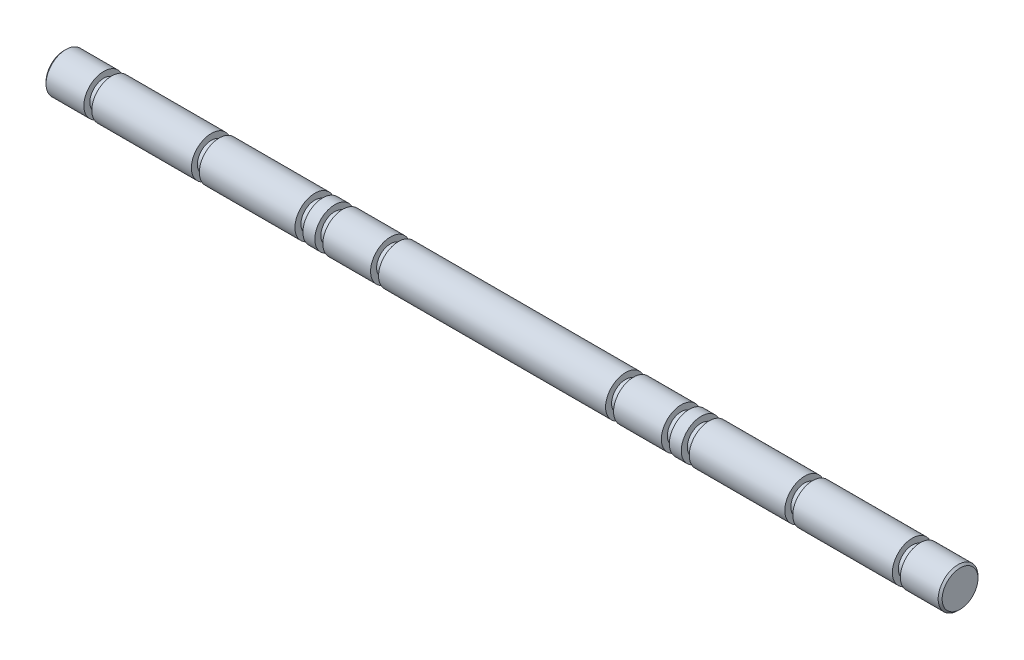
from build123d import *

# Parameters (mm, degrees)
SKETCH_4_R       = 5
EXTRUDE_4_DEPTH  = 57
SKETCH_5_R       = 3.5
EXTRUDE_5_DEPTH  = 2
EXTRUDE_START    = 12
SKETCH_6_R       = 5
EXTRUDE_6_DEPTH  = 12
EXTRUDE_START_2  = 2
SKETCH_7_R       = 3.5
EXTRUDE_7_DEPTH  = 2
SKETCH_8_R       = 5
EXTRUDE_8_DEPTH  = 12
SKETCH_9_R       = 3.5
EXTRUDE_9_DEPTH  = 2
SKETCH_10_R      = 5
EXTRUDE_10_DEPTH = 3
SKETCH_11_R      = 3.5
EXTRUDE_11_DEPTH = 2
SKETCH_12_R      = 5
EXTRUDE_12_DEPTH = 24
SKETCH_13_R      = 3.5
EXTRUDE_13_DEPTH = 2
SKETCH_14_R      = 5
EXTRUDE_14_DEPTH = 25
SKETCH_15_R      = 3.5
EXTRUDE_15_DEPTH = 2
SKETCH_16_R      = 5
EXTRUDE_16_DEPTH = 10
SKETCH_33_R      = 3.5
EXTRUDE_25_DEPTH = 2
EXTRUDE_START_3  = 3
SKETCH_34_R      = 5
EXTRUDE_26_DEPTH = 3
SKETCH_35_R      = 3.5
EXTRUDE_27_DEPTH = 2
EXTRUDE_START_4  = 24
SKETCH_36_R      = 5
EXTRUDE_28_DEPTH = 24
SKETCH_37_R      = 3.5
EXTRUDE_29_DEPTH = 2
EXTRUDE_START_5  = 25
SKETCH_38_R      = 5
EXTRUDE_30_DEPTH = 25
SKETCH_39_R      = 3.5
EXTRUDE_31_DEPTH = 2
EXTRUDE_START_6  = 10
SKETCH_40_R      = 5
EXTRUDE_32_DEPTH = 10
CHAMFER_1_SIZE   = 0.5


with BuildPart() as part:
    # 草图4 → 凸台-拉伸4 (new body)
    with BuildSketch(Plane(origin=(0, 0, 0), x_dir=(0, 0, -1), z_dir=(1, 0, 0))):
        with Locations(Location((0, 0, 0), (0, 0, 180))):
            Circle(SKETCH_4_R)
    extrude(amount=EXTRUDE_4_DEPTH)

    # 草图5 → 凸台-拉伸5 (add)
    with BuildSketch(Plane.ZY):
        Circle(SKETCH_5_R)
    extrude(amount=EXTRUDE_5_DEPTH)

    # 草图6 → 凸台-拉伸6 (add)
    with BuildSketch(Plane.ZY.offset(2).offset(EXTRUDE_START)):
        Circle(SKETCH_6_R)
    extrude(amount=-EXTRUDE_6_DEPTH)

    # 草图7 → 凸台-拉伸7 (add)
    with BuildSketch(Plane(origin=(57, 0, 0), x_dir=(0, 0, -1), z_dir=(1, 0, 0)).offset(EXTRUDE_START_2)):
        with Locations(Location((0, 0, 0), (0, 0, 180))):
            Circle(SKETCH_7_R)
    extrude(amount=-EXTRUDE_7_DEPTH)

    # 草图8 → 凸台-拉伸8 (add)
    with BuildSketch(Plane(origin=(59, 0, 0), x_dir=(0, 0, -1), z_dir=(1, 0, 0))):
        with Locations(Location((0, 0, 0), (0, 0, 180))):
            Circle(SKETCH_8_R)
    extrude(amount=EXTRUDE_8_DEPTH)

    # 草图9 → 凸台-拉伸9 (add)
    with BuildSketch(Plane(origin=(71, 0, 0), x_dir=(0, 0, -1), z_dir=(1, 0, 0)).offset(EXTRUDE_START_2)):
        with Locations(Location((0, 0, 0), (0, 0, 180))):
            Circle(SKETCH_9_R)
    extrude(amount=-EXTRUDE_9_DEPTH)

    # 草图10 → 凸台-拉伸10 (add)
    with BuildSketch(Plane(origin=(73, 0, 0), x_dir=(0, 0, -1), z_dir=(1, 0, 0))):
        with Locations(Location((0, 0, 0), (0, 0, 180))):
            Circle(SKETCH_10_R)
    extrude(amount=EXTRUDE_10_DEPTH)

    # 草图11 → 凸台-拉伸11 (add)
    with BuildSketch(Plane(origin=(76, 0, 0), x_dir=(0, 0, -1), z_dir=(1, 0, 0)).offset(EXTRUDE_START_2)):
        with Locations(Location((0, 0, 0), (0, 0, 180))):
            Circle(SKETCH_11_R)
    extrude(amount=-EXTRUDE_11_DEPTH)

    # 草图12 → 凸台-拉伸12 (add)
    with BuildSketch(Plane(origin=(78, 0, 0), x_dir=(0, 0, -1), z_dir=(1, 0, 0))):
        with Locations(Location((0, 0, 0), (0, 0, 180))):
            Circle(SKETCH_12_R)
    extrude(amount=EXTRUDE_12_DEPTH)

    # 草图13 → 凸台-拉伸13 (add)
    with BuildSketch(Plane(origin=(102, 0, 0), x_dir=(0, 0, -1), z_dir=(1, 0, 0)).offset(EXTRUDE_START_2)):
        with Locations(Location((0, 0, 0), (0, 0, 180))):
            Circle(SKETCH_13_R)
    extrude(amount=-EXTRUDE_13_DEPTH)

    # 草图14 → 凸台-拉伸14 (add)
    with BuildSketch(Plane(origin=(104, 0, 0), x_dir=(0, 0, -1), z_dir=(1, 0, 0))):
        with Locations(Location((0, 0, 0), (0, 0, 180))):
            Circle(SKETCH_14_R)
    extrude(amount=EXTRUDE_14_DEPTH)

    # 草图15 → 凸台-拉伸15 (add)
    with BuildSketch(Plane(origin=(129, 0, 0), x_dir=(0, 0, -1), z_dir=(1, 0, 0)).offset(EXTRUDE_START_2)):
        with Locations(Location((0, 0, 0), (0, 0, 180))):
            Circle(SKETCH_15_R)
    extrude(amount=-EXTRUDE_15_DEPTH)

    # 草图16 → 凸台-拉伸16 (add)
    with BuildSketch(Plane(origin=(131, 0, 0), x_dir=(0, 0, -1), z_dir=(1, 0, 0))):
        with Locations(Location((0, 0, 0), (0, 0, 180))):
            Circle(SKETCH_16_R)
    extrude(amount=EXTRUDE_16_DEPTH)

    # 草图33 → 凸台-拉伸25 (add)
    with BuildSketch(Plane.ZY.offset(14)):
        Circle(SKETCH_33_R)
    extrude(amount=EXTRUDE_25_DEPTH)

    # 草图34 → 凸台-拉伸26 (add)
    with BuildSketch(Plane.ZY.offset(16).offset(EXTRUDE_START_3)):
        Circle(SKETCH_34_R)
    extrude(amount=-EXTRUDE_26_DEPTH)

    # 草图35 → 凸台-拉伸27 (add)
    with BuildSketch(Plane.ZY.offset(19)):
        Circle(SKETCH_35_R)
    extrude(amount=EXTRUDE_27_DEPTH)

    # 草图36 → 凸台-拉伸28 (add)
    with BuildSketch(Plane.ZY.offset(21).offset(EXTRUDE_START_4)):
        Circle(SKETCH_36_R)
    extrude(amount=-EXTRUDE_28_DEPTH)

    # 草图37 → 凸台-拉伸29 (add)
    with BuildSketch(Plane.ZY.offset(45)):
        Circle(SKETCH_37_R)
    extrude(amount=EXTRUDE_29_DEPTH)

    # 草图38 → 凸台-拉伸30 (add)
    with BuildSketch(Plane.ZY.offset(47).offset(EXTRUDE_START_5)):
        Circle(SKETCH_38_R)
    extrude(amount=-EXTRUDE_30_DEPTH)

    # 草图39 → 凸台-拉伸31 (add)
    with BuildSketch(Plane.ZY.offset(72)):
        Circle(SKETCH_39_R)
    extrude(amount=EXTRUDE_31_DEPTH)

    # 草图40 → 凸台-拉伸32 (add)
    with BuildSketch(Plane.ZY.offset(74).offset(EXTRUDE_START_6)):
        Circle(SKETCH_40_R)
    extrude(amount=-EXTRUDE_32_DEPTH)

    # 倒角1
    chamfer_1_edges = [part.edges().sort_by_distance(p)[0] for p in [
        (141, 0, -5),
        (-84, 0, -5),
    ]]
    chamfer(chamfer_1_edges, length=CHAMFER_1_SIZE)


solid = part.part
